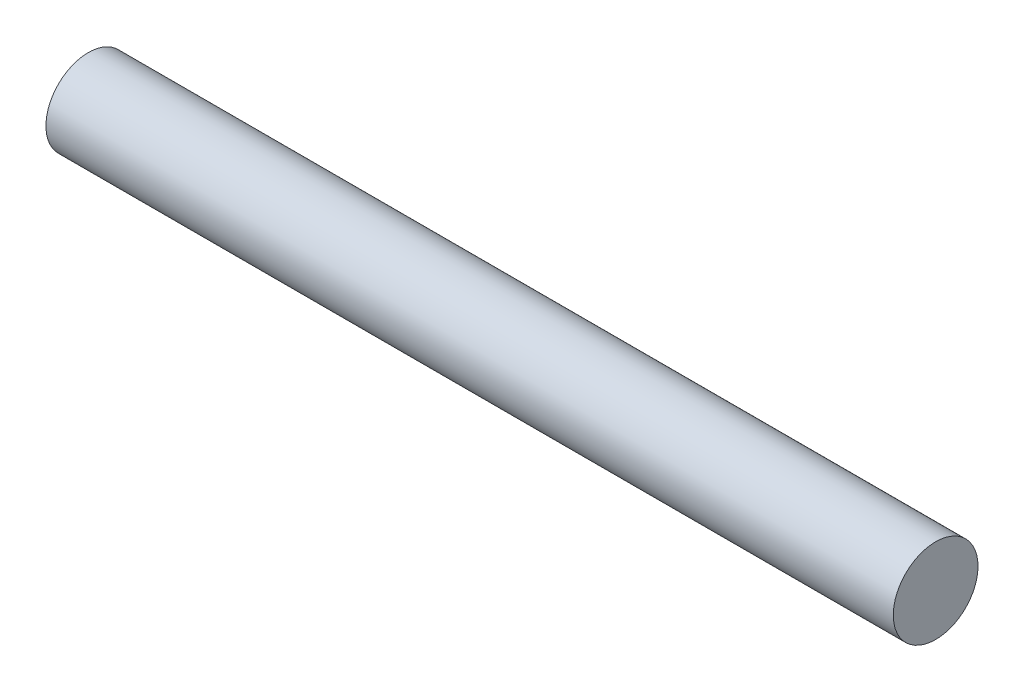
from build123d import *

# Parameters (mm, degrees)
SKETCH1_R           = 10
BOSS_EXTRUDE1_DEPTH = 200


with BuildPart() as part:
    # Sketch1 → Boss-Extrude1 (new body)
    with BuildSketch(Plane(origin=(0, 0, 0), x_dir=(0, 0, -1), z_dir=(1, 0, 0))):
        Circle(SKETCH1_R)
    extrude(amount=BOSS_EXTRUDE1_DEPTH)


solid = part.part
